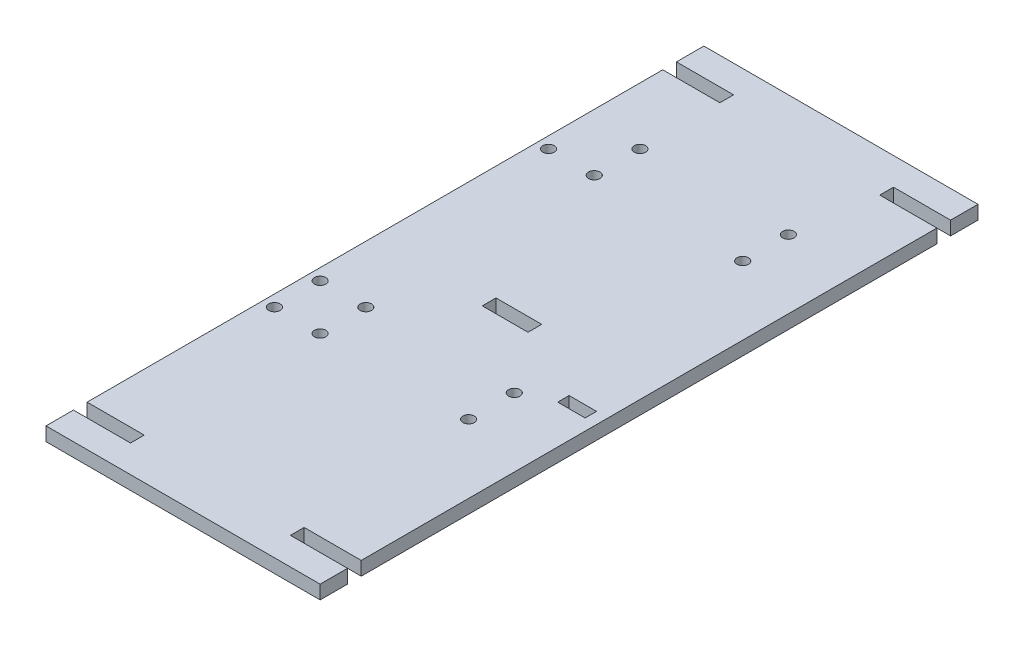
from build123d import *

# Parameters (mm, degrees)
SKETCH1_W            = 120
SKETCH1_H            = 288
BOSS_EXTRUDE1_DEPTH  = 6
SKETCH2_W            = 25
SKETCH2_H            = 6
CUT_EXTRUDE1_DEPTH   = 313.057686975
LPATTERN1_COUNT      = 2
LPATTERN1_PITCH      = 258
LPATTERN1_COUNT_DIR2 = 2
LPATTERN1_PITCH_DIR2 = 95
SKETCH3_W            = 20
SKETCH3_H            = 6
CUT_EXTRUDE2_DEPTH   = 10
SKETCH4_R            = 2.5
CUT_EXTRUDE4_DEPTH   = 10
SKETCH6_W            = 12
SKETCH6_H            = 5
CUT_EXTRUDE5_DEPTH   = 10


with BuildPart() as part:
    # Sketch1 → Boss-Extrude1 (new body)
    with BuildSketch(Plane(origin=(0, 0, 0), x_dir=(1, 0, 0), z_dir=(0, 1, 0))):
        with Locations((-60, 144)):
            Rectangle(SKETCH1_W, SKETCH1_H)
    extrude(amount=BOSS_EXTRUDE1_DEPTH)

    # Sketch2 → Cut-Extrude1 (cut, through all)
    with BuildSketch(Plane(origin=(0, 6, 0), x_dir=(1, 0, 0), z_dir=(0, 1, 0))):
        with Locations((-107.5, 273)):
            Rectangle(SKETCH2_W, SKETCH2_H)
    cut_extrude1 = extrude(amount=-CUT_EXTRUDE1_DEPTH, mode=Mode.SUBTRACT)

    # LPattern1: Cut-Extrude1 2 × 2
    with Locations(*[(j * LPATTERN1_PITCH_DIR2, 0, i * LPATTERN1_PITCH) for i in range(LPATTERN1_COUNT) for j in range(LPATTERN1_COUNT_DIR2) if (i, j) != (0, 0)]):
        add(cut_extrude1, mode=Mode.SUBTRACT)

    # Sketch3 → Cut-Extrude2 (cut)
    with BuildSketch(Plane(origin=(0, 6, 0), x_dir=(1, 0, 0), z_dir=(0, 1, 0))):
        with Locations((-60, 144)):
            Rectangle(SKETCH3_W, SKETCH3_H)
    extrude(amount=-CUT_EXTRUDE2_DEPTH, mode=Mode.SUBTRACT)

    # Sketch4 → Cut-Extrude4 (cut)
    with BuildSketch(Plane(origin=(0, 6, 0), x_dir=(1, 0, 0), z_dir=(0, 1, 0))):
        with Locations(Location((-30, 235, 0), (0, 0, 270))):
            Circle(SKETCH4_R)
        with Locations(Location((-30, 215, 0), (0, 0, 270))):
            Circle(SKETCH4_R)
        with Locations(Location((-95, 235, 0), (0, 0, 270))):
            Circle(SKETCH4_R)
        with Locations(Location((-95, 215, 0), (0, 0, 270))):
            Circle(SKETCH4_R)
        with Locations(Location((-115, 215, 0), (0, 0, 270))):
            Circle(SKETCH4_R)
        with Locations(Location((-95, 115, 0), (0, 0, 270))):
            Circle(SKETCH4_R)
        with Locations(Location((-115, 115, 0), (0, 0, 270))):
            Circle(SKETCH4_R)
        with Locations(Location((-95, 95, 0), (0, 0, 270))):
            Circle(SKETCH4_R)
        with Locations(Location((-30, 115, 0), (0, 0, 270))):
            Circle(SKETCH4_R)
        with Locations(Location((-30, 95, 0), (0, 0, 270))):
            Circle(SKETCH4_R)
        with Locations(Location((-115, 95, 0), (0, 0, 270))):
            Circle(SKETCH4_R)
    extrude(amount=-CUT_EXTRUDE4_DEPTH, mode=Mode.SUBTRACT)

    # Sketch6 → Cut-Extrude5 (cut)
    with BuildSketch(Plane(origin=(0, 6, 0), x_dir=(1, 0, 0), z_dir=(0, 1, 0))):
        with Locations((-11, 123.5)):
            Rectangle(SKETCH6_W, SKETCH6_H)
    extrude(amount=-CUT_EXTRUDE5_DEPTH, mode=Mode.SUBTRACT)


solid = part.part
